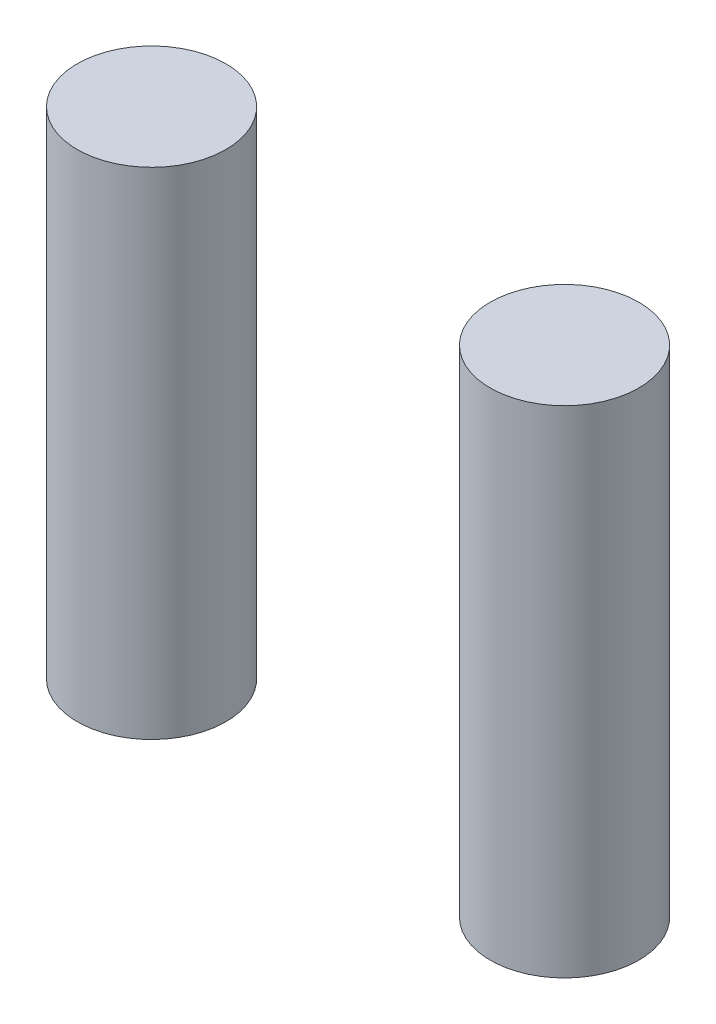
from build123d import *

# Parameters (mm, degrees)
SKETCH1_R             = 1.143
BOSS_EXTRUDE1_DEPTH   = 7.62
BOSS_EXTRUDE1_2_DEPTH = 7.62


with BuildPart() as part:
    # Sketch1 → Boss-Extrude1 (new body)
    with BuildSketch(Plane(origin=(0, 0, 0), x_dir=(1, 0, 0), z_dir=(0, 1, 0))):
        with Locations(Location((0, 0, 0), (0, 0, 90))):
            Circle(SKETCH1_R)
    extrude(amount=BOSS_EXTRUDE1_DEPTH)


with BuildPart() as body_2:
    # Sketch1 → Boss-Extrude1 2 (new body)
    with BuildSketch(Plane(origin=(0, 0, 0), x_dir=(1, 0, 0), z_dir=(0, 1, 0))):
        with Locations(Location((6.35, 0, 0), (0, 0, 90))):
            Circle(SKETCH1_R)
    extrude(amount=BOSS_EXTRUDE1_2_DEPTH)


solid = Compound([part.part, body_2.part])
